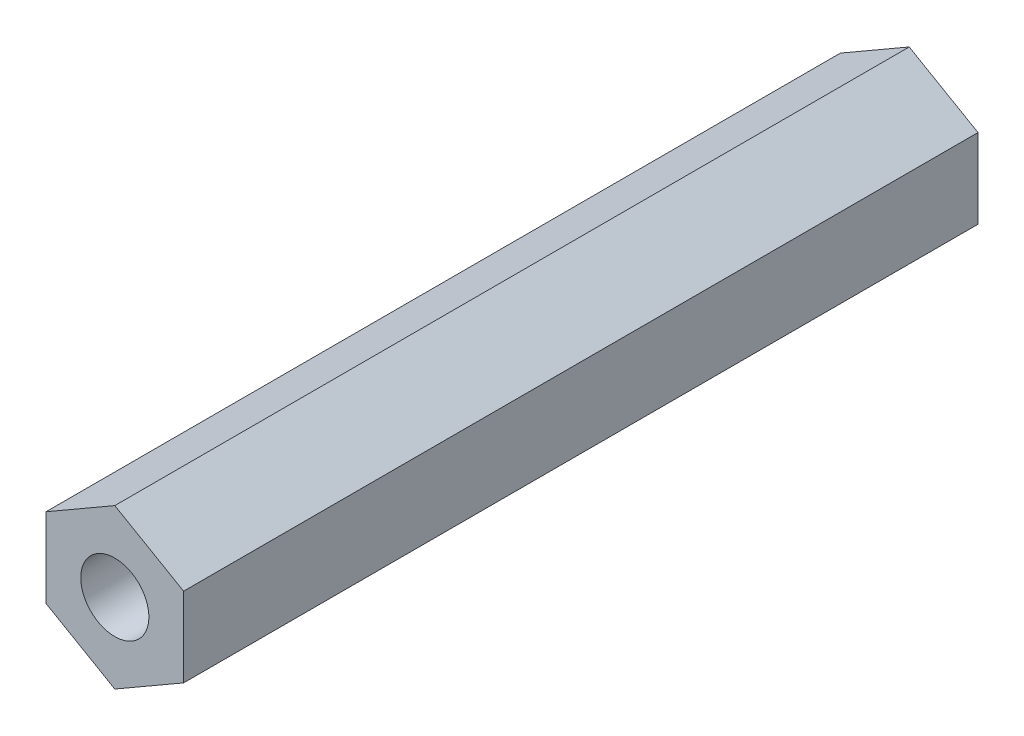
from build123d import *

# Parameters (mm, degrees)
BOSS_EXTRUDE1_DEPTH = 35
SKETCH3_R           = 1.5
CUT_EXTRUDE1_DEPTH  = 35


with BuildPart() as part:
    # Sketch2 → Boss-Extrude1 (new body)
    with BuildSketch(Plane.XY):
        Polygon((0, -3.5), (3.031088913, -1.75), (3.031088913, 1.75), (0, 3.5), (-3.031088913, 1.75), (-3.031088913, -1.75), align=None)
    extrude(amount=BOSS_EXTRUDE1_DEPTH)

    # Sketch3 → Cut-Extrude1 (cut)
    with BuildSketch(Plane(origin=(0, 0, 0), x_dir=(-1, 0, 0), z_dir=(0, 0, -1))):
        Circle(SKETCH3_R)
    extrude(amount=-CUT_EXTRUDE1_DEPTH, mode=Mode.SUBTRACT)


solid = part.part
